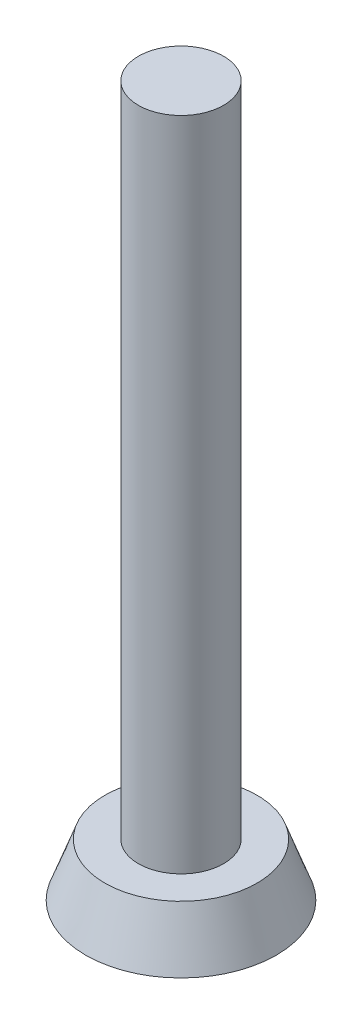
from build123d import *

# Parameters (mm, degrees)
SKETCH1_R           = 3.36
BOSS_EXTRUDE1_DEPTH = 1.86
BOSS_EXTRUDE1_TAPER = 20
SKETCH2_R           = 1.5
BOSS_EXTRUDE2_DEPTH = 23.14
CUT_EXTRUDE1_DEPTH  = 1.5


with BuildPart() as part:
    # Sketch1 → Boss-Extrude1 (new body)
    with BuildSketch(Plane(origin=(0, 0, 0), x_dir=(1, 0, 0), z_dir=(0, 1, 0))):
        Circle(SKETCH1_R)
    extrude(amount=BOSS_EXTRUDE1_DEPTH, taper=BOSS_EXTRUDE1_TAPER)

    # Sketch2 → Boss-Extrude2 (add)
    with BuildSketch(Plane(origin=(0, 1.86, 0), x_dir=(1, 0, 0), z_dir=(0, 1, 0))):
        with Locations(Location((0, 0, 0), (0, 0, 270))):
            Circle(SKETCH2_R)
    extrude(amount=BOSS_EXTRUDE2_DEPTH)

    # Sketch3 → Cut-Extrude1 (cut)
    with BuildSketch(Plane.XZ):
        Polygon((0, 1.154700538), (-1, 0.577350269), (-1, -0.577350269), (0, -1.154700538), (1, -0.577350269), (1, 0.577350269), align=None)
    extrude(amount=-CUT_EXTRUDE1_DEPTH, mode=Mode.SUBTRACT)


solid = part.part
